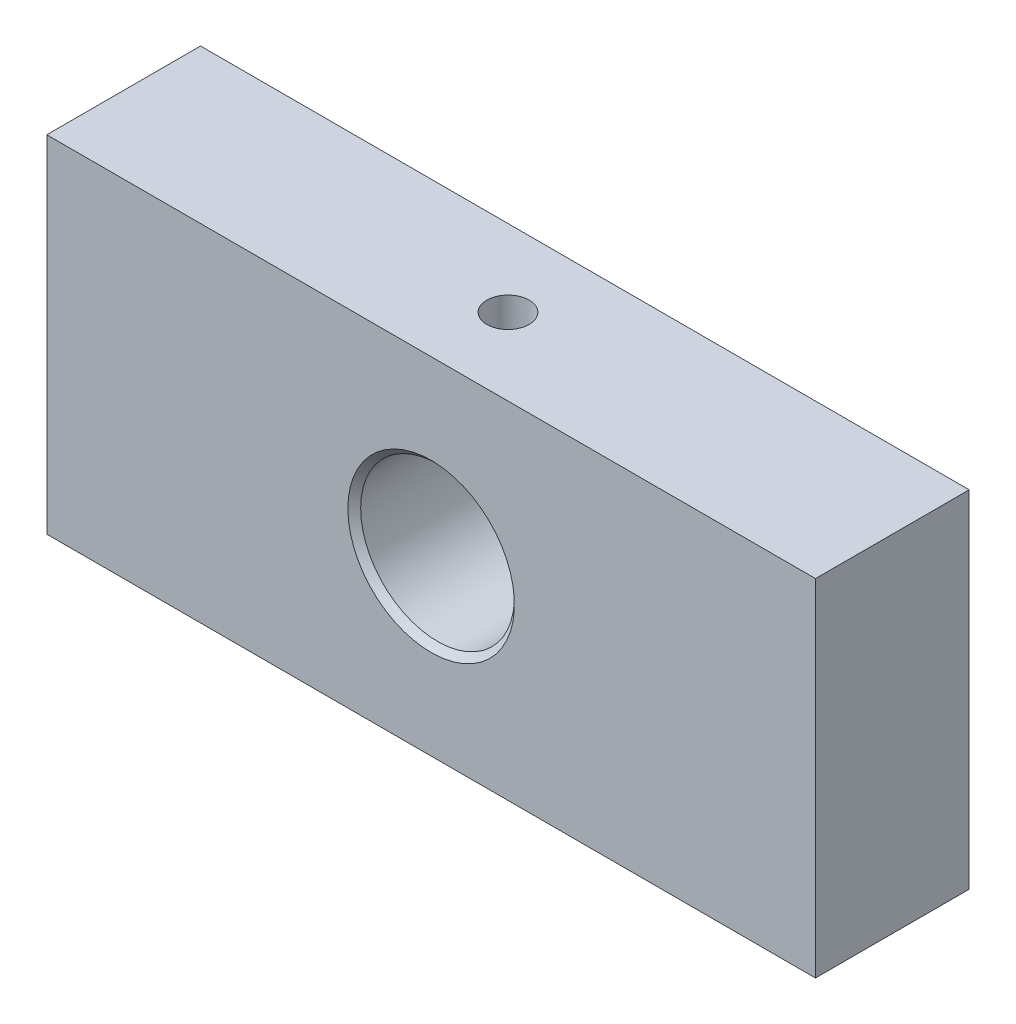
from build123d import *

# Parameters (mm, degrees)
SKETCH2_W                            = 60
SKETCH2_H                            = 27
BOSS_EXTRUDE1_DEPTH                  = 12
F_12_0MM_CLEARANCE_DOWEL_HOLE1_D     = 12
F_12_0MM_CLEARANCE_DOWEL_HOLE1_DEPTH = 12.4
F_12_0MM_CLEARANCE_DOWEL_HOLE1_TIP   = 3.605163714
M4_TAPPED_HOLE1_D                    = 3.3
M4_TAPPED_HOLE1_DEPTH                = 10.1
M4_TAPPED_HOLE1_TIP                  = 0.991420021
CHAMFER1_SIZE                        = 0.5
F_5_0MM_CLEARANCE_DOWEL_HOLE3_D      = 5
F_5_0MM_CLEARANCE_DOWEL_HOLE3_DEPTH  = 10
F_5_0MM_CLEARANCE_DOWEL_HOLE3_TIP    = 1.502151548
M5_TAPPED_HOLE3_D                    = 4.2
M5_TAPPED_HOLE3_DEPTH                = 10
M5_TAPPED_HOLE3_TIP                  = 1.2618073
M5_TAPPED_HOLE4_D                    = 4.2
M5_TAPPED_HOLE4_DEPTH                = 10
M5_TAPPED_HOLE4_TIP                  = 1.2618073
F_5_0MM_CLEARANCE_DOWEL_HOLE4_D      = 5
F_5_0MM_CLEARANCE_DOWEL_HOLE4_DEPTH  = 12.4
F_5_0MM_CLEARANCE_DOWEL_HOLE4_TIP    = 1.502151548


with BuildPart() as part:
    # Sketch2 → Boss-Extrude1 (new body)
    with BuildSketch(Plane.XY):
        with Locations((30, 13.5)):
            Rectangle(SKETCH2_W, SKETCH2_H)
    extrude(amount=BOSS_EXTRUDE1_DEPTH)

    # Ø12.0mm Clearance Dowel Hole1
    with Locations(Plane.XY.offset(12)):
        with Locations((30, 13.5)):
            Hole(F_12_0MM_CLEARANCE_DOWEL_HOLE1_D / 2, depth=F_12_0MM_CLEARANCE_DOWEL_HOLE1_DEPTH)
            with Locations((0, 0, -(F_12_0MM_CLEARANCE_DOWEL_HOLE1_DEPTH + F_12_0MM_CLEARANCE_DOWEL_HOLE1_TIP / 2))):  # 118° drill point
                Cone(0, F_12_0MM_CLEARANCE_DOWEL_HOLE1_D / 2, F_12_0MM_CLEARANCE_DOWEL_HOLE1_TIP, mode=Mode.SUBTRACT)

    # M4 Tapped Hole1
    with Locations(Plane(origin=(0, 27, 0), x_dir=(1, 0, 0), z_dir=(0, 1, 0))):
        with Locations((30, -6)):
            Hole(M4_TAPPED_HOLE1_D / 2, depth=M4_TAPPED_HOLE1_DEPTH)
            with Locations((0, 0, -(M4_TAPPED_HOLE1_DEPTH + M4_TAPPED_HOLE1_TIP / 2))):  # 118° drill point
                Cone(0, M4_TAPPED_HOLE1_D / 2, M4_TAPPED_HOLE1_TIP, mode=Mode.SUBTRACT)

    # Chamfer1
    chamfer1_edges = [part.edges().sort_by_distance(p)[0] for p in [
        (36, 13.5, 12),
    ]]
    chamfer(chamfer1_edges, length=CHAMFER1_SIZE)

    # Ø5.0mm Clearance Dowel Hole3
    with Locations(Plane(origin=(8, 0, 6), x_dir=(0, 0, -1), z_dir=(0, -1, 0))):
        with Locations((0, 0)):
            Hole(F_5_0MM_CLEARANCE_DOWEL_HOLE3_D / 2, depth=F_5_0MM_CLEARANCE_DOWEL_HOLE3_DEPTH)
            with Locations((0, 0, -(F_5_0MM_CLEARANCE_DOWEL_HOLE3_DEPTH + F_5_0MM_CLEARANCE_DOWEL_HOLE3_TIP / 2))):  # 118° drill point
                Cone(0, F_5_0MM_CLEARANCE_DOWEL_HOLE3_D / 2, F_5_0MM_CLEARANCE_DOWEL_HOLE3_TIP, mode=Mode.SUBTRACT)

    # M5 Tapped Hole3
    with Locations(Plane(origin=(16, 0, 6), x_dir=(0, 0, -1), z_dir=(0, -1, 0))):
        with Locations((0, 0)):
            Hole(M5_TAPPED_HOLE3_D / 2, depth=M5_TAPPED_HOLE3_DEPTH)
            with Locations((0, 0, -(M5_TAPPED_HOLE3_DEPTH + M5_TAPPED_HOLE3_TIP / 2))):  # 118° drill point
                Cone(0, M5_TAPPED_HOLE3_D / 2, M5_TAPPED_HOLE3_TIP, mode=Mode.SUBTRACT)

    # M5 Tapped Hole4
    with Locations(Plane(origin=(44, 0, 6), x_dir=(0, 0, -1), z_dir=(0, -1, 0))):
        with Locations((0, 0)):
            Hole(M5_TAPPED_HOLE4_D / 2, depth=M5_TAPPED_HOLE4_DEPTH)
            with Locations((0, 0, -(M5_TAPPED_HOLE4_DEPTH + M5_TAPPED_HOLE4_TIP / 2))):  # 118° drill point
                Cone(0, M5_TAPPED_HOLE4_D / 2, M5_TAPPED_HOLE4_TIP, mode=Mode.SUBTRACT)

    # Ø5.0mm Clearance Dowel Hole4
    with Locations(Plane(origin=(52, 0, 6), x_dir=(0, 0, -1), z_dir=(0, -1, 0))):
        with Locations((0, 0)):
            Hole(F_5_0MM_CLEARANCE_DOWEL_HOLE4_D / 2, depth=F_5_0MM_CLEARANCE_DOWEL_HOLE4_DEPTH)
            with Locations((0, 0, -(F_5_0MM_CLEARANCE_DOWEL_HOLE4_DEPTH + F_5_0MM_CLEARANCE_DOWEL_HOLE4_TIP / 2))):  # 118° drill point
                Cone(0, F_5_0MM_CLEARANCE_DOWEL_HOLE4_D / 2, F_5_0MM_CLEARANCE_DOWEL_HOLE4_TIP, mode=Mode.SUBTRACT)


solid = part.part
